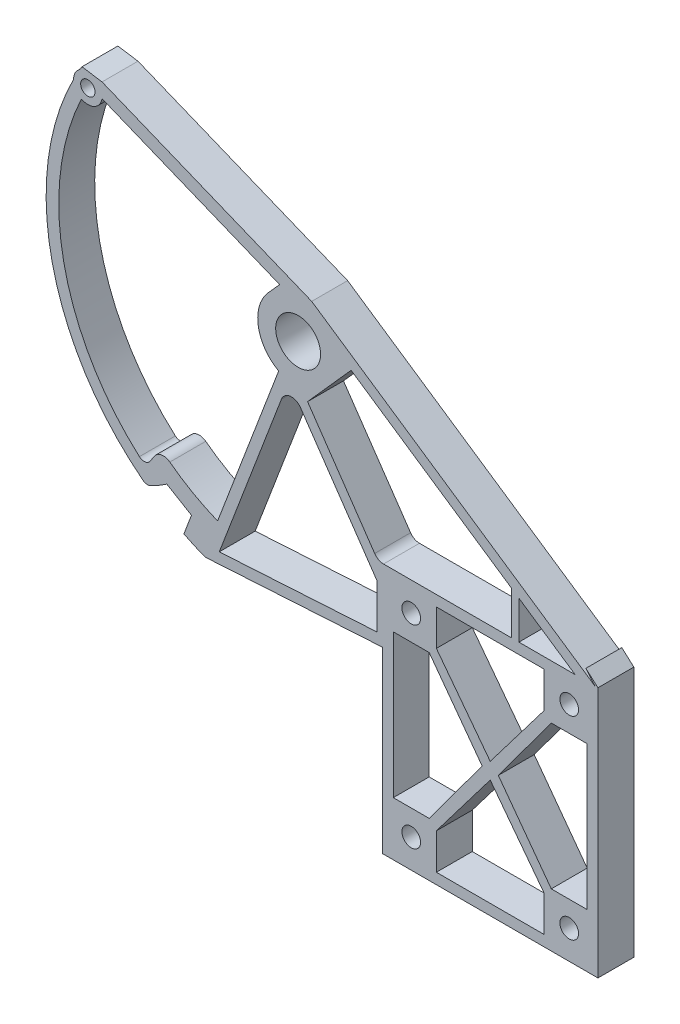
from build123d import *

# Parameters (mm, degrees)
BOSS_EXTRUDE1_DEPTH = 12.7
SKETCH2_R           = 7.9375
CUT_EXTRUDE1_DEPTH  = 25.4
CUT_EXTRUDE2_DEPTH  = 15.24
CUT_EXTRUDE4_DEPTH  = 12.7
CUT_EXTRUDE3_DEPTH  = 12.7
FILLET4_R           = 3.81
CUT_EXTRUDE8_REACH  = 306.459
SKETCH10_R          = 3.302
CUT_EXTRUDE9_DEPTH  = 12.7
CUT_EXTRUDE10_DEPTH = 15.24
FILLET8_R           = 2.54
FILLET9_R           = 3.81
CUT_EXTRUDE11_DEPTH = 12.7
BOSS_EXTRUDE2_DEPTH = 12.7
SKETCH16_R          = 5.08
SKETCH16_R_2        = 2.54
BOSS_EXTRUDE3_DEPTH = 12.7
SKETCH17_R          = 2.54
CUT_EXTRUDE12_DEPTH = 12.7
CUT_EXTRUDE13_DEPTH = 12.7
BOSS_EXTRUDE4_DEPTH = 12.7


with BuildPart() as part:
    # Sketch1 → Boss-Extrude1 (new body)
    with BuildSketch(Plane.XY):
        with BuildLine():
            Line((22.605250022, 67.052290313), (98.805250022, 67.052290313))
            Line((98.805250022, 67.052290313), (98.805250022, 155.952290313))
            Line((98.805250022, 155.952290313), (-49.161223166, 287.699993186))
            ThreePointArc((-49.161223166, 287.699993186), (-96.236474745, 204.218681994), (-40.152034083, 126.502891159))
            Line((-40.152034083, 126.502891159), (22.605250022, 130.274128502))
            Line((22.605250022, 130.274128502), (22.605250022, 67.052290313))
        make_face()
    extrude(amount=BOSS_EXTRUDE1_DEPTH)

    # Sketch2 → Cut-Extrude1 (cut)
    with BuildSketch(Plane.XY.offset(12.7)):
        with Locations((-7.239749978, 209.038290313)):
            Circle(SKETCH2_R)
    extrude(amount=-CUT_EXTRUDE1_DEPTH, mode=Mode.SUBTRACT)

    # Sketch3 → Cut-Extrude2 (cut)
    with BuildSketch(Plane.XY.offset(12.7)):
        Polygon((41.655250022, 70.862290313), (41.655250022, 83.562290313), (60.705250022, 108.644790313), (79.755250022, 83.562290313), (79.755250022, 70.862290313), align=None)
        Polygon((26.415250022, 86.102290313), (39.115250022, 86.102290313), (57.847750022, 111.502290313), (39.115250022, 136.902290313), (26.415250022, 136.902290313), align=None)
        Polygon((94.995250022, 86.102290313), (82.295250022, 86.102290313), (63.562750022, 111.502290313), (82.295250022, 136.902290313), (94.995250022, 136.902290313), align=None)
        Polygon((41.655250022, 152.142290313), (41.655250022, 139.442290313), (60.705250022, 114.359790313), (79.755250022, 139.442290313), (79.755250022, 152.142290313), align=None)
    extrude(amount=-CUT_EXTRUDE2_DEPTH, mode=Mode.SUBTRACT)

    # Sketch5 → Cut-Extrude4 (cut)
    with BuildSketch(Plane.XY.offset(12.7)):
        with BuildLine():
            Line((-17.910409102, 218.539326578), (-0.75941726, 237.80168728))
            Line((-0.75941726, 237.80168728), (-42.818220106, 275.250377791))
            ThreePointArc((-42.818220106, 275.250377791), (-82.302366375, 205.259118271), (-35.720460653, 139.777057558))
            Line((-35.720460653, 139.777057558), (-14.124378137, 196.518923262))
            ThreePointArc((-14.124378137, 196.518923262), (-21.320643715, 206.617321953), (-17.910409102, 218.539326578))
        make_face()
        with BuildLine():
            Line((3.983097906, 233.579004496), (-5.26797782, 223.189077245))
            ThreePointArc((-5.26797782, 223.189077245), (1.977645927, 219.954895508), (6.380422315, 213.353792944))
            Line((6.380422315, 213.353792944), (15.365134305, 223.444565813))
            Line((15.365134305, 223.444565813), (3.983097906, 233.579004496))
        make_face()
        Polygon((20.700250022, 133.976525379), (20.700250022, 149.602290313), (-10.546123475, 195.20949671), (-35.128405597, 130.621646119), align=None)
    extrude(amount=-CUT_EXTRUDE4_DEPTH, mode=Mode.SUBTRACT)

    # Sketch4 → Cut-Extrude3 (cut)
    with BuildSketch(Plane.XY.offset(12.7)):
        Polygon((20.968161353, 155.952290313), (-3.903453401, 192.254898923), (20.952186028, 220.170386062), (68.306030681, 178.007049188), (68.306030681, 155.952290313), align=None)
        Polygon((91.166030681, 155.952290313), (70.846030681, 155.952290313), (70.846030681, 174.044992428), align=None)
    extrude(amount=-CUT_EXTRUDE3_DEPTH, mode=Mode.SUBTRACT)

    # Fillet4
    fillet4_edges = [part.edges().sort_by_distance(p)[0] for p in [
        (-10.546123475, 195.20949671, 6.35),
        (20.968161353, 155.952290313, 6.35),
    ]]
    fillet(fillet4_edges, radius=FILLET4_R)

    # Sketch10 → Cut-Extrude8 (cut, up to next)
    with BuildSketch(Plane.XY.offset(12.7), mode=Mode.PRIVATE) as cut_extrude8_sk1:
        with Locations((32.765250022, 77.212290313)):
            Circle(SKETCH10_R)
    cut_extrude8_tool1 = extrude(cut_extrude8_sk1.sketch, amount=-CUT_EXTRUDE8_REACH, mode=Mode.PRIVATE) & part.part
    # Sketch10 → Cut-Extrude8 (cut, up to next)
    with BuildSketch(Plane.XY.offset(12.7), mode=Mode.PRIVATE) as cut_extrude8_sk2:
        with Locations((32.765250022, 145.792290313)):
            Circle(SKETCH10_R)
    cut_extrude8_tool2 = extrude(cut_extrude8_sk2.sketch, amount=-CUT_EXTRUDE8_REACH, mode=Mode.PRIVATE) & part.part
    # Sketch10 → Cut-Extrude8 (cut, up to next)
    with BuildSketch(Plane.XY.offset(12.7), mode=Mode.PRIVATE) as cut_extrude8_sk3:
        with Locations((88.645250022, 145.792290313)):
            Circle(SKETCH10_R)
    cut_extrude8_tool3 = extrude(cut_extrude8_sk3.sketch, amount=-CUT_EXTRUDE8_REACH, mode=Mode.PRIVATE) & part.part
    # Sketch10 → Cut-Extrude8 (cut, up to next)
    with BuildSketch(Plane.XY.offset(12.7), mode=Mode.PRIVATE) as cut_extrude8_sk4:
        with Locations((88.645250022, 77.212290313)):
            Circle(SKETCH10_R)
    cut_extrude8_tool4 = extrude(cut_extrude8_sk4.sketch, amount=-CUT_EXTRUDE8_REACH, mode=Mode.PRIVATE) & part.part
    add(cut_extrude8_tool1.solids().sort_by_distance((32.76525, 77.21229, 12.7))[0], mode=Mode.SUBTRACT)
    add(cut_extrude8_tool2.solids().sort_by_distance((32.76525, 145.79229, 12.7))[0], mode=Mode.SUBTRACT)
    add(cut_extrude8_tool3.solids().sort_by_distance((88.64525, 145.79229, 12.7))[0], mode=Mode.SUBTRACT)
    add(cut_extrude8_tool4.solids().sort_by_distance((88.64525, 77.21229, 12.7))[0], mode=Mode.SUBTRACT)

    # Sketch11 → Cut-Extrude9 (cut)
    with BuildSketch(Plane.XY.offset(12.7)):
        with BuildLine():
            Line((-53.699981311, 142.099051734), (-44.964720503, 136.910524137))
            Line((-44.964720503, 136.910524137), (-50.020521881, 123.626837035))
            Line((-50.020521881, 123.626837035), (-66.867730014, 134.987909964))
            ThreePointArc((-66.867730014, 134.987909964), (-63.911601381, 136.652385518), (-60.829717039, 138.070540751))
            ThreePointArc((-60.829717039, 138.070540751), (-57.16682096, 139.911304034), (-53.699981311, 142.099051734))
        make_face()
    extrude(amount=-CUT_EXTRUDE9_DEPTH, mode=Mode.SUBTRACT)

    # Sketch13 → Cut-Extrude10 (cut)
    with BuildSketch(Plane.XY.offset(12.7)):
        with BuildLine():
            Line((-50.310364079, 281.9212995), (-42.818220106, 275.250377791))
            Line((-42.818220106, 275.250377791), (-55.824588323, 151.935966869))
            Line((-55.824588323, 151.935966869), (-61.138010202, 143.754384394))
            ThreePointArc((-61.138010202, 143.754384394), (-91.639185725, 215.652371712), (-50.310364079, 281.9212995))
        make_face()
    extrude(amount=-CUT_EXTRUDE10_DEPTH, mode=Mode.SUBTRACT)

    # Fillet8
    fillet8_edges = [part.edges().sort_by_distance(p)[0] for p in [
        (-60.829717039, 138.070540751, 6.35),
        (-61.138010202, 143.754384394, 6.35),
    ]]
    fillet(fillet8_edges, radius=FILLET8_R)

    # Fillet9
    fillet9_edges = [part.edges().sort_by_distance(p)[0] for p in [
        (-55.824588323, 151.935966869, 6.35),
    ]]
    fillet(fillet9_edges, radius=FILLET9_R)

    # Sketch14 → Cut-Extrude11 (cut)
    with BuildSketch(Plane.XY.offset(12.7)):
        Polygon((-0.75941726, 237.80168728), (-90.284904, 256.297301642), (-56.503441725, 294.237422972), (2.618728967, 241.595699413), align=None)
    extrude(amount=-CUT_EXTRUDE11_DEPTH, mode=Mode.SUBTRACT)

    # Sketch15 → Boss-Extrude2 (add)
    with BuildSketch(Plane.XY.offset(12.7)):
        Polygon((2.618728967, 241.595699413), (-83.695447283, 254.935945734), (-84.471371658, 249.915553183), (-1.404499457, 237.07719239), align=None)
    extrude(amount=-BOSS_EXTRUDE2_DEPTH)

    # Sketch16 → Boss-Extrude3 (add)
    with BuildSketch(Plane.XY.offset(12.7)):
        with Locations((-81.616731922, 249.474355701)):
            Circle(SKETCH16_R)
        with Locations((-81.616731922, 249.474355701)):
            Circle(SKETCH16_R_2, mode=Mode.SUBTRACT)
    extrude(amount=-BOSS_EXTRUDE3_DEPTH)

    # Sketch17 → Cut-Extrude12 (cut)
    with BuildSketch(Plane.XY.offset(12.7)):
        with Locations((-81.616731922, 249.474355701)):
            Circle(SKETCH17_R)
    extrude(amount=-CUT_EXTRUDE12_DEPTH, mode=Mode.SUBTRACT)

    # Sketch18 → Cut-Extrude13 (cut)
    with BuildSketch(Plane.XY.offset(12.7)):
        Polygon((-76.596339371, 248.698431326), (1.977645927, 219.954895508), (91.166030681, 155.952290313), (97.725254163, 155.952290313), (11.18255191, 258.990487802), (-76.596339371, 256.904187462), align=None)
    extrude(amount=-CUT_EXTRUDE13_DEPTH, mode=Mode.SUBTRACT)

    # Sketch20 → Boss-Extrude4 (add)
    with BuildSketch(Plane.XY.offset(12.7)):
        Polygon((90.745298735, 155.952290313), (-0.889749978, 217.928290313), (-76.596339371, 248.698431326), (-76.596339371, 253.838746498), (-2.444151583, 223.700375546), (97.725254163, 155.952290313), align=None)
    extrude(amount=-BOSS_EXTRUDE4_DEPTH)


solid = part.part
